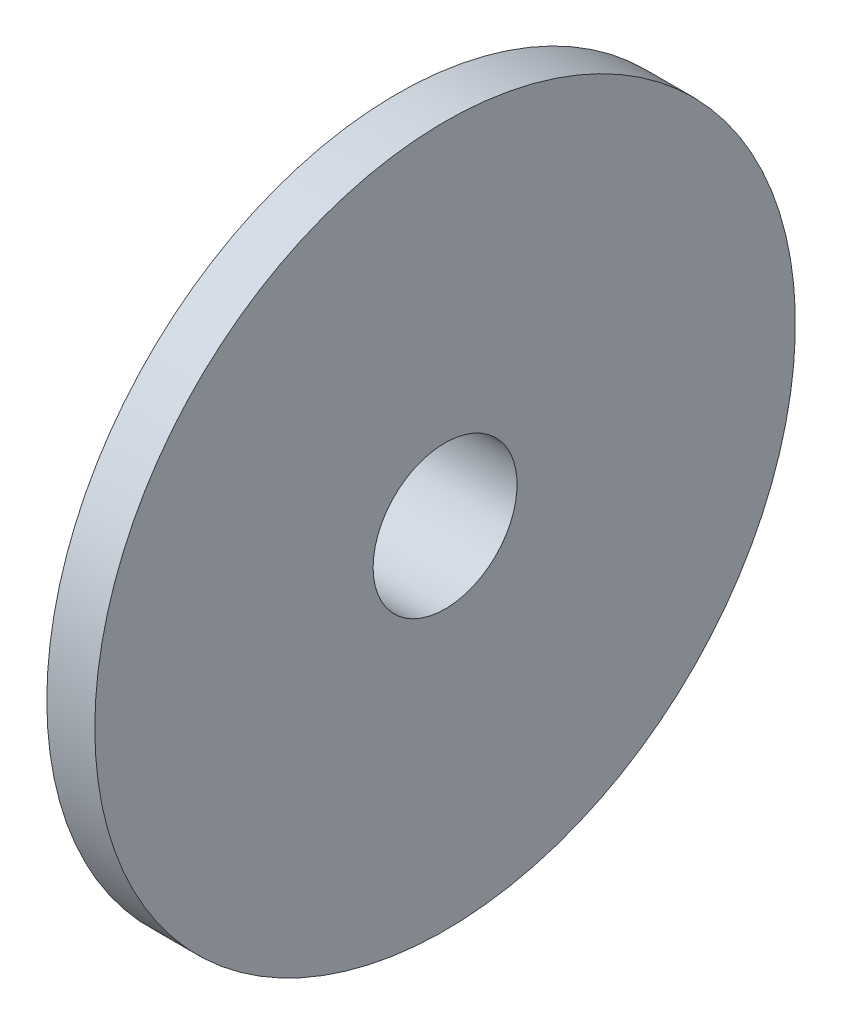
from build123d import *

# Parameters (mm, degrees)
CHAMFER_1_SIZE = 0.2


with BuildPart() as part:
    # 草图1 → 旋转1 (revolve)
    with BuildSketch(Plane.XY, mode=Mode.PRIVATE) as revolve_1_sk:
        Polygon((0, 1.5), (0, 7.3), (-1, 7.3), (-1, 2.75), (-3, 2.75), (-3, 1.5), align=None)
    revolve(revolve_1_sk.sketch.rotate(Axis((-9.1, 0, 0), (1, 0, 0)), 90), axis=Axis((-9.1, 0, 0), (1, 0, 0)))

    # 倒角1
    chamfer_1_edges = [part.edges().sort_by_distance(p)[0] for p in [
        (-3, 0, -1.5),
        (-3, 0, -2.75),
    ]]
    chamfer(chamfer_1_edges, length=CHAMFER_1_SIZE)


solid = part.part
